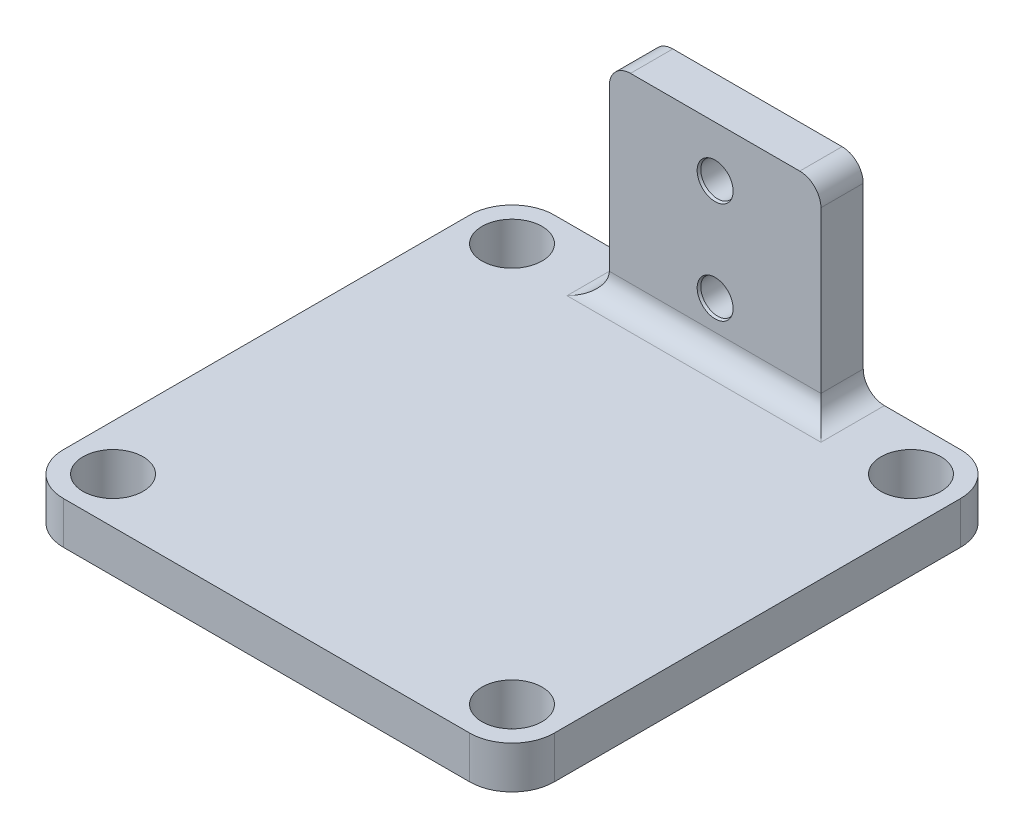
from build123d import *

# Parameters (mm, degrees)
SKETCH1_W                         = 58
SKETCH1_H                         = 58
SKETCH1_R                         = 3.55
BOSS_EXTRUDE1_DEPTH               = 5
FILLET1_R                         = 5
BOSS_EXTRUDE2_START               = -29
SKETCH5_W                         = 25
SKETCH5_H                         = 24
BOSS_EXTRUDE2_DEPTH               = 5
F_4_0_4_DIAMETER_HOLE1_AT_2_COUNT = 2
F_4_0_4_DIAMETER_HOLE1_AT_2_PITCH = 12
FILLET2_R                         = 2.5


with BuildPart() as part:
    # Sketch1 → Boss-Extrude1 (new body)
    with BuildSketch(Plane(origin=(0, 0, 0), x_dir=(1, 0, 0), z_dir=(0, 1, 0))):
        Rectangle(SKETCH1_W, SKETCH1_H)
        with Locations(Location((-23.57, 23.57, 0), (0, 0, 270))):
            Circle(SKETCH1_R, mode=Mode.SUBTRACT)
        with Locations(Location((23.57, 23.57, 0), (0, 0, 270))):
            Circle(SKETCH1_R, mode=Mode.SUBTRACT)
        with Locations(Location((23.57, -23.57, 0), (0, 0, 270))):
            Circle(SKETCH1_R, mode=Mode.SUBTRACT)
        with Locations(Location((-23.57, -23.57, 0), (0, 0, 270))):
            Circle(SKETCH1_R, mode=Mode.SUBTRACT)
    extrude(amount=BOSS_EXTRUDE1_DEPTH)

    # Fillet1
    fillet1_edges = [part.edges().sort_by_distance(p)[0] for p in [
        (29, 2.5, 29),
        (-29, 2.5, 29),
        (-29, 2.5, -29),
        (29, 2.5, -29),
    ]]
    fillet(fillet1_edges, radius=FILLET1_R)

    # Sketch5 → Boss-Extrude2 (add)
    with BuildSketch(Plane.XY.offset(BOSS_EXTRUDE2_START)):
        with Locations((0, 17)):
            Rectangle(SKETCH5_W, SKETCH5_H)
    extrude(amount=BOSS_EXTRUDE2_DEPTH)

    # Sketch7 → Ø4.0 (4) Diameter Hole1 (revolve, cut)
    with BuildSketch(Plane(origin=(0, 11, -24), x_dir=(0, -1, 0), z_dir=(1, 0, 0))):
        Polygon((0, 0), (0, 5), (2, 5), (2, 0.301776695), (2.125, 0), align=None)
    f_4_0_4_diameter_hole1 = revolve(axis=Axis((0, 11, -17.65), (0, 0, -1)), mode=Mode.SUBTRACT)

    # Ø4.0 (4) Diameter Hole1 at 2: Ø4.0 (4) Diameter Hole1 ×2
    with Locations(*[(0, i * F_4_0_4_DIAMETER_HOLE1_AT_2_PITCH, 0) for i in range(1, F_4_0_4_DIAMETER_HOLE1_AT_2_COUNT)]):
        add(f_4_0_4_diameter_hole1, mode=Mode.SUBTRACT)

    # Fillet2
    fillet2_edges = [part.edges().sort_by_distance(p)[0] for p in [
        (-12.5, 5, -26.5),
        (12.5, 5, -26.5),
        (12.5, 29, -26.5),
        (-12.5, 29, -26.5),
        (0, 5, -24),
    ]]
    fillet(fillet2_edges, radius=FILLET2_R)


solid = part.part
